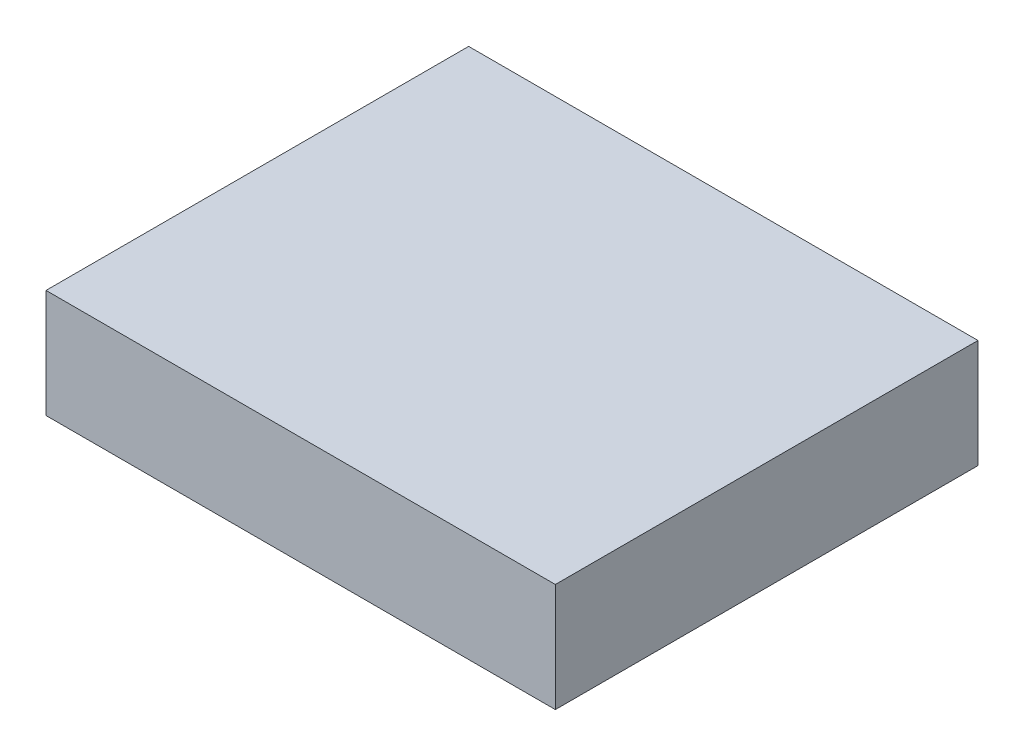
from build123d import *

# Parameters (mm, degrees)
SKETCH1_W           = 47
SKETCH1_H           = 39
BOSS_EXTRUDE1_DEPTH = 10


with BuildPart() as part:
    # Sketch1 → Boss-Extrude1 (new body)
    with BuildSketch(Plane(origin=(0, 0, 0), x_dir=(1, 0, 0), z_dir=(0, 1, 0))):
        with Locations((-23.5, 19.5)):
            Rectangle(SKETCH1_W, SKETCH1_H)
    extrude(amount=BOSS_EXTRUDE1_DEPTH)


solid = part.part
